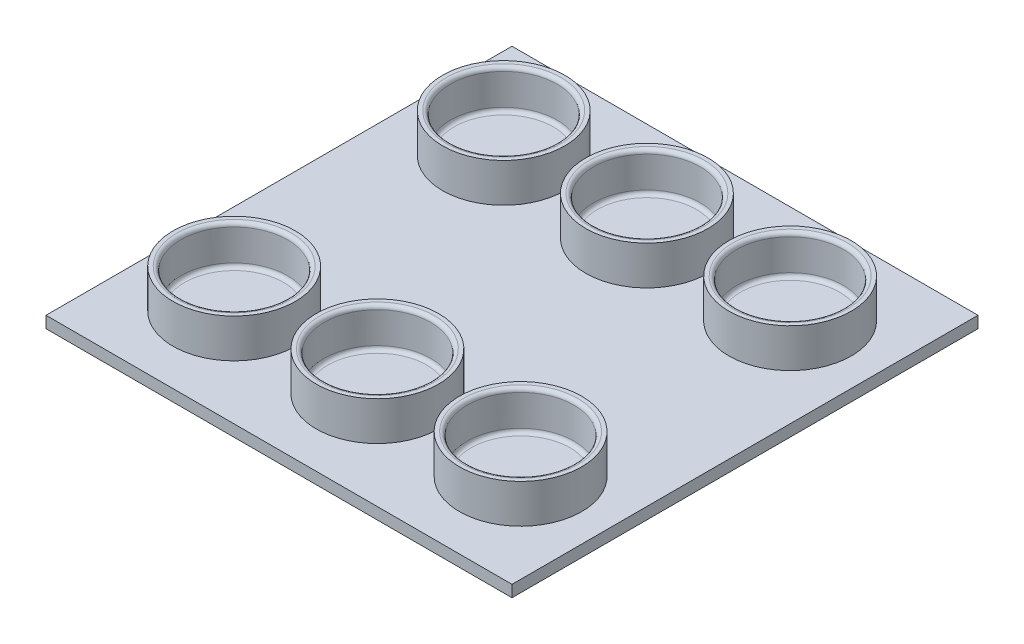
from build123d import *

# Parameters (mm, degrees)
SKETCH3_W           = 120
SKETCH3_H           = 120
BOSS_EXTRUDE1_DEPTH = 3
SKETCH5_R           = 15.75
SKETCH5_R_2         = 13.75
BOSS_EXTRUDE2_DEPTH = 10
FILLET2_R           = 1
FILLET3_R           = 1


with BuildPart() as part:
    # Sketch3 → Boss-Extrude1 (new body)
    with BuildSketch(Plane(origin=(0, 0, 0), x_dir=(1, 0, 0), z_dir=(0, 1, 0))):
        Rectangle(SKETCH3_W, SKETCH3_H)
    extrude(amount=BOSS_EXTRUDE1_DEPTH)

    # Sketch5 → Boss-Extrude2 (add)
    # profile 1 of 6: a face of its own
    with BuildSketch(Plane(origin=(0, 3, 0), x_dir=(1, 0, 0), z_dir=(0, 1, 0))):
        with Locations(Location((0.149707612, 34.593788931, 0), (0, 0, 270))):
            Circle(SKETCH5_R)
        with Locations(Location((0.149707612, 34.593788931, 0), (0, 0, 270))):
            Circle(SKETCH5_R_2, mode=Mode.SUBTRACT)
    # profile 2 of 6: a face of its own
    with BuildSketch(Plane(origin=(0, 3, 0), x_dir=(1, 0, 0), z_dir=(0, 1, 0))):
        with Locations(Location((0.149707612, -34.81460035, 0), (0, 0, 90))):
            Circle(SKETCH5_R)
        with Locations(Location((0.149707612, -34.81460035, 0), (0, 0, 90))):
            Circle(SKETCH5_R_2, mode=Mode.SUBTRACT)
    # profile 3 of 6: a face of its own
    with BuildSketch(Plane(origin=(0, 3, 0), x_dir=(1, 0, 0), z_dir=(0, 1, 0))):
        with Locations(Location((37.024707612, -34.81460035, 0), (0, 0, 90))):
            Circle(SKETCH5_R)
        with Locations(Location((37.024707612, -34.81460035, 0), (0, 0, 90))):
            Circle(SKETCH5_R_2, mode=Mode.SUBTRACT)
    # profile 4 of 6: a face of its own
    with BuildSketch(Plane(origin=(0, 3, 0), x_dir=(1, 0, 0), z_dir=(0, 1, 0))):
        with Locations(Location((37.024707612, 34.593788931, 0), (0, 0, 270))):
            Circle(SKETCH5_R)
        with Locations(Location((37.024707612, 34.593788931, 0), (0, 0, 270))):
            Circle(SKETCH5_R_2, mode=Mode.SUBTRACT)
    # profile 5 of 6: a face of its own
    with BuildSketch(Plane(origin=(0, 3, 0), x_dir=(1, 0, 0), z_dir=(0, 1, 0))):
        with Locations(Location((-36.730292388, -34.81460035, 0), (0, 0, 90))):
            Circle(SKETCH5_R)
        with Locations(Location((-36.730292388, -34.81460035, 0), (0, 0, 90))):
            Circle(SKETCH5_R_2, mode=Mode.SUBTRACT)
    # profile 6 of 6: a face of its own
    with BuildSketch(Plane(origin=(0, 3, 0), x_dir=(1, 0, 0), z_dir=(0, 1, 0))):
        with Locations(Location((-36.730292388, 34.593788931, 0), (0, 0, 270))):
            Circle(SKETCH5_R)
        with Locations(Location((-36.730292388, 34.593788931, 0), (0, 0, 270))):
            Circle(SKETCH5_R_2, mode=Mode.SUBTRACT)
    extrude(amount=BOSS_EXTRUDE2_DEPTH)

    # Fillet2
    fillet2_edges = [part.edges().sort_by_distance(p)[0] for p in [
        (0.149707612, 13, -48.343788931),
        (0.149707612, 3, 48.56460035),
        (37.024707612, 13, 48.56460035),
        (37.024707612, 3, -48.343788931),
        (-36.730292388, 3, 48.56460035),
        (-36.730292388, 13, -48.343788931),
    ]]
    fillet(fillet2_edges, radius=FILLET2_R)

    # Fillet3
    fillet3_edges = [part.edges().sort_by_distance(p)[0] for p in [
        (0.149707612, 3, -48.343788931),
        (0.149707612, 13, 48.56460035),
        (37.024707612, 3, 48.56460035),
        (37.024707612, 13, -48.343788931),
        (-36.730292388, 13, 48.56460035),
        (-36.730292388, 3, -48.343788931),
    ]]
    fillet(fillet3_edges, radius=FILLET3_R)


solid = part.part
